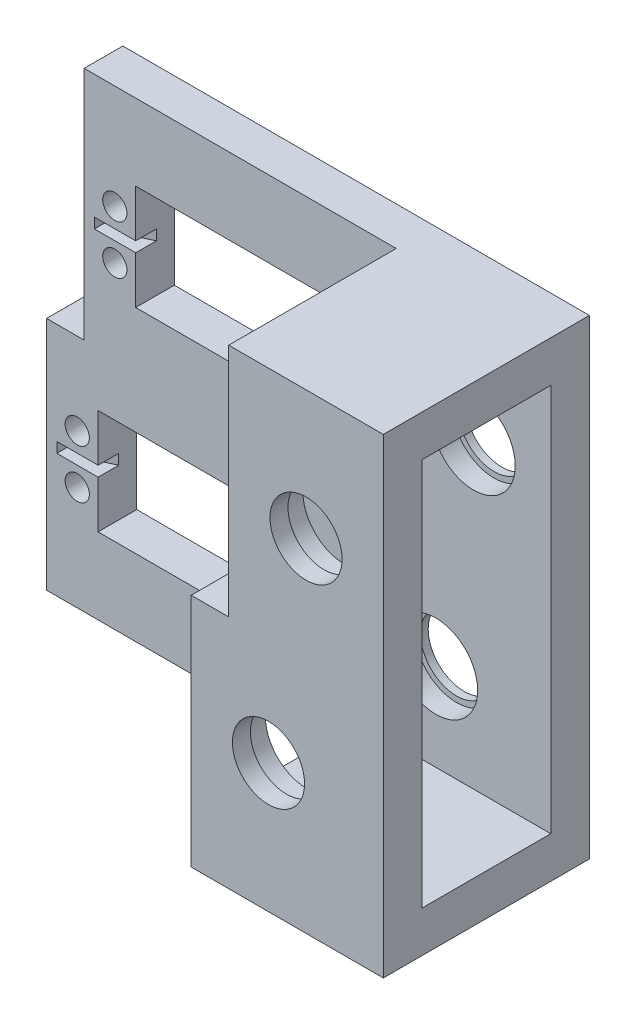
from build123d import *
from OCP.BRepFilletAPI import BRepFilletAPI_MakeChamfer

# Parameters (mm, degrees)
SKETCH1_W           = 37.293223462
SKETCH1_H           = 91.361925627
SKETCH1_R           = 8.1
BOSS_EXTRUDE1_DEPTH = 40
CUT_EXTRUDE1_START  = 8
SKETCH2_W           = 37.293223462
SKETCH2_H           = 25
CUT_EXTRUDE1_DEPTH  = 95.195837814
BOSS_EXTRUDE2_START = -3.5
SKETCH10_R          = 8.1
SKETCH10_R_2        = 7
SKETCH10_R_3        = 10.837031589
BOSS_EXTRUDE2_DEPTH = 3.5
SKETCH11_R          = 8.1
SKETCH11_R_2        = 7
BOSS_EXTRUDE3_DEPTH = 3.5
SKETCH12_W          = 40.9
SKETCH12_H          = 20.4
BOSS_EXTRUDE4_DEPTH = 7.5
CUT_EXTRUDE2_REACH  = 127.125
SKETCH13_R          = 2.3495
SKETCH22_W          = 8
SKETCH22_H          = 2
CUT_EXTRUDE6_DEPTH  = 2
SKETCH14_W          = 37.293223462
SKETCH14_H          = 8
BOSS_EXTRUDE5_DEPTH = 25
CUT_EXTRUDE4_START  = -32.5
SKETCH18_W          = 7.293223462
SKETCH18_H          = 45.680962814
CUT_EXTRUDE4_DEPTH  = 32.5
SKETCH15_R          = 11
CUT_EXTRUDE3_DEPTH  = 2
CHAMFER2_SIZE       = 2
CHAMFER2_SIZE2      = 4.289013841


with BuildPart() as part:
    # Sketch1 → Boss-Extrude1 (new body)
    with BuildSketch(Plane.XY):
        with Locations((3.646611731, 45.680962814)):
            Rectangle(SKETCH1_W, SKETCH1_H)
        with Locations((0, 25)):
            Circle(SKETCH1_R, mode=Mode.SUBTRACT)
        with Locations((7.293223462, 66.361925627)):
            Circle(SKETCH1_R, mode=Mode.SUBTRACT)
    extrude(amount=BOSS_EXTRUDE1_DEPTH)

    # Sketch2 → Cut-Extrude1 (cut, through all)
    with BuildSketch(Plane(origin=(0, 0, 0), x_dir=(1, 0, 0), z_dir=(0, 1, 0)).offset(CUT_EXTRUDE1_START)):
        with Locations((3.646611731, -20)):
            Rectangle(SKETCH2_W, SKETCH2_H)
    extrude(amount=CUT_EXTRUDE1_DEPTH, mode=Mode.SUBTRACT)

    # Sketch10 → Boss-Extrude2 (add)
    # profile 1 of 2: a face of its own
    with BuildSketch(Plane.XY.offset(40).offset(BOSS_EXTRUDE2_START)):
        with Locations(Location((7.293223462, 66.361925627, 0), (0, 0, 180))):
            Circle(SKETCH10_R)
        with Locations((7.293223462, 66.361925627)):
            Circle(SKETCH10_R_2, mode=Mode.SUBTRACT)
    # profile 2 of 2: a face of its own
    with BuildSketch(Plane.XY.offset(40).offset(BOSS_EXTRUDE2_START)):
        with Locations((0, 25)):
            Circle(SKETCH10_R_3)
        with Locations((0, 25)):
            Circle(SKETCH10_R_2, mode=Mode.SUBTRACT)
    extrude(amount=BOSS_EXTRUDE2_DEPTH)

    # Sketch11 → Boss-Extrude3 (add)
    # profile 1 of 2: a face of its own
    with BuildSketch(Plane(origin=(0, 0, 0), x_dir=(-1, 0, 0), z_dir=(0, 0, -1))):
        with Locations((-7.293223462, 66.361925627)):
            Circle(SKETCH11_R)
        with Locations(Location((-7.293223462, 66.361925627, 0), (0, 0, 180))):
            Circle(SKETCH11_R_2, mode=Mode.SUBTRACT)
    # profile 2 of 2: a face of its own
    with BuildSketch(Plane(origin=(0, 0, 0), x_dir=(-1, 0, 0), z_dir=(0, 0, -1))):
        with Locations((0, 25)):
            Circle(SKETCH11_R)
        with Locations(Location((0, 25, 0), (0, 0, 180))):
            Circle(SKETCH11_R_2, mode=Mode.SUBTRACT)
    extrude(amount=-BOSS_EXTRUDE3_DEPTH)

    # Sketch12 → Boss-Extrude4 (add)
    with BuildSketch(Plane(origin=(0, 0, 0), x_dir=(-1, 0, 0), z_dir=(0, 0, -1))):
        Polygon((15, 0), (75.56, 0), (75.56, 45.680962813), (68.266776538, 45.680962813), (68.266776538, 91.361925627), (15, 91.361925627), align=None)
        with Locations((45.11, 25)):
            Rectangle(SKETCH12_W, SKETCH12_H, mode=Mode.SUBTRACT)
        with Locations((37.816776538, 66.361925627)):
            Rectangle(SKETCH12_W, SKETCH12_H, mode=Mode.SUBTRACT)
    extrude(amount=-BOSS_EXTRUDE4_DEPTH)

    # Sketch13 → Cut-Extrude2 (cut, up to next)
    with BuildSketch(Plane(origin=(0, 0, 0), x_dir=(-1, 0, 0), z_dir=(0, 0, -1)), mode=Mode.PRIVATE) as cut_extrude2_sk1:
        with Locations((20.61, 29.75)):
            Circle(SKETCH13_R)
    cut_extrude2_tool1 = extrude(cut_extrude2_sk1.sketch, amount=-CUT_EXTRUDE2_REACH, mode=Mode.PRIVATE) & part.part
    # Sketch13 → Cut-Extrude2 (cut, up to next)
    with BuildSketch(Plane(origin=(0, 0, 0), x_dir=(-1, 0, 0), z_dir=(0, 0, -1)), mode=Mode.PRIVATE) as cut_extrude2_sk2:
        with Locations((20.61, 20.25)):
            Circle(SKETCH13_R)
    cut_extrude2_tool2 = extrude(cut_extrude2_sk2.sketch, amount=-CUT_EXTRUDE2_REACH, mode=Mode.PRIVATE) & part.part
    # Sketch13 → Cut-Extrude2 (cut, up to next)
    with BuildSketch(Plane(origin=(0, 0, 0), x_dir=(-1, 0, 0), z_dir=(0, 0, -1)), mode=Mode.PRIVATE) as cut_extrude2_sk3:
        with Locations((69.61, 29.75)):
            Circle(SKETCH13_R)
    cut_extrude2_tool3 = extrude(cut_extrude2_sk3.sketch, amount=-CUT_EXTRUDE2_REACH, mode=Mode.PRIVATE) & part.part
    # Sketch13 → Cut-Extrude2 (cut, up to next)
    with BuildSketch(Plane(origin=(0, 0, 0), x_dir=(-1, 0, 0), z_dir=(0, 0, -1)), mode=Mode.PRIVATE) as cut_extrude2_sk4:
        with Locations((69.61, 20.25)):
            Circle(SKETCH13_R)
    cut_extrude2_tool4 = extrude(cut_extrude2_sk4.sketch, amount=-CUT_EXTRUDE2_REACH, mode=Mode.PRIVATE) & part.part
    # Sketch13 → Cut-Extrude2 (cut, up to next)
    with BuildSketch(Plane(origin=(0, 0, 0), x_dir=(-1, 0, 0), z_dir=(0, 0, -1)), mode=Mode.PRIVATE) as cut_extrude2_sk5:
        with Locations((13.316776538, 71.111925627)):
            Circle(SKETCH13_R)
    cut_extrude2_tool5 = extrude(cut_extrude2_sk5.sketch, amount=-CUT_EXTRUDE2_REACH, mode=Mode.PRIVATE) & part.part
    # Sketch13 → Cut-Extrude2 (cut, up to next)
    with BuildSketch(Plane(origin=(0, 0, 0), x_dir=(-1, 0, 0), z_dir=(0, 0, -1)), mode=Mode.PRIVATE) as cut_extrude2_sk6:
        with Locations((13.316776538, 61.611925627)):
            Circle(SKETCH13_R)
    cut_extrude2_tool6 = extrude(cut_extrude2_sk6.sketch, amount=-CUT_EXTRUDE2_REACH, mode=Mode.PRIVATE) & part.part
    # Sketch13 → Cut-Extrude2 (cut, up to next)
    with BuildSketch(Plane(origin=(0, 0, 0), x_dir=(-1, 0, 0), z_dir=(0, 0, -1)), mode=Mode.PRIVATE) as cut_extrude2_sk7:
        with Locations((62.316776538, 71.111925627)):
            Circle(SKETCH13_R)
    cut_extrude2_tool7 = extrude(cut_extrude2_sk7.sketch, amount=-CUT_EXTRUDE2_REACH, mode=Mode.PRIVATE) & part.part
    # Sketch13 → Cut-Extrude2 (cut, up to next)
    with BuildSketch(Plane(origin=(0, 0, 0), x_dir=(-1, 0, 0), z_dir=(0, 0, -1)), mode=Mode.PRIVATE) as cut_extrude2_sk8:
        with Locations((62.316776538, 61.611925627)):
            Circle(SKETCH13_R)
    cut_extrude2_tool8 = extrude(cut_extrude2_sk8.sketch, amount=-CUT_EXTRUDE2_REACH, mode=Mode.PRIVATE) & part.part
    add(cut_extrude2_tool1.solids().sort_by_distance((-20.61, 29.75, 0))[0], mode=Mode.SUBTRACT)
    add(cut_extrude2_tool2.solids().sort_by_distance((-20.61, 20.25, 0))[0], mode=Mode.SUBTRACT)
    add(cut_extrude2_tool3.solids().sort_by_distance((-69.61, 29.75, 0))[0], mode=Mode.SUBTRACT)
    add(cut_extrude2_tool4.solids().sort_by_distance((-69.61, 20.25, 0))[0], mode=Mode.SUBTRACT)
    add(cut_extrude2_tool5.solids().sort_by_distance((-13.316777, 71.111926, 0))[0], mode=Mode.SUBTRACT)
    add(cut_extrude2_tool6.solids().sort_by_distance((-13.316777, 61.611926, 0))[0], mode=Mode.SUBTRACT)
    add(cut_extrude2_tool7.solids().sort_by_distance((-62.316777, 71.111926, 0))[0], mode=Mode.SUBTRACT)
    add(cut_extrude2_tool8.solids().sort_by_distance((-62.316777, 61.611926, 0))[0], mode=Mode.SUBTRACT)

    # Sketch22 → Cut-Extrude6 (cut)
    with BuildSketch(Plane.XY.offset(7.5)):
        with Locations((-62.266776538, 66.361925627)):
            Rectangle(SKETCH22_W, SKETCH22_H)
        with Locations((-13.366776538, 66.361925627)):
            Rectangle(SKETCH22_W, SKETCH22_H)
        with Locations((-20.66, 25)):
            Rectangle(SKETCH22_W, SKETCH22_H)
        with Locations((-69.56, 25)):
            Rectangle(SKETCH22_W, SKETCH22_H)
    extrude(amount=-CUT_EXTRUDE6_DEPTH, mode=Mode.SUBTRACT)

    # Sketch14 → Boss-Extrude5 (add)
    with BuildSketch(Plane.XY.offset(7.5)):
        with Locations((3.646611731, 87.361925627)):
            Rectangle(SKETCH14_W, SKETCH14_H)
    extrude(amount=BOSS_EXTRUDE5_DEPTH)

    # Sketch18 → Cut-Extrude4 (cut)
    with BuildSketch(Plane.XY.offset(40).offset(CUT_EXTRUDE4_START)):
        with Locations((-11.353388269, 68.52144422)):
            Rectangle(SKETCH18_W, SKETCH18_H)
    extrude(amount=CUT_EXTRUDE4_DEPTH, mode=Mode.SUBTRACT)

    # Sketch15 → Cut-Extrude3 (cut)
    with BuildSketch(Plane(origin=(0, 0, 0), x_dir=(-1, 0, 0), z_dir=(0, 0, -1))):
        with Locations((0, 25)):
            Circle(SKETCH15_R)
        with Locations((-7.293223462, 66.361925627)):
            Circle(SKETCH15_R)
    extrude(amount=-CUT_EXTRUDE3_DEPTH, mode=Mode.SUBTRACT)

    # Chamfer2: one chamfer whose edges measure the first distance from different faces: ONE call of the kernel's chamfer builder (chamfer() names one face for all edges)
    chamfer2_edges_1 = [part.edges().sort_by_distance(p)[0] for p in [
        (-65.56, 25, 5.5),
    ]]
    chamfer2_side_1 = [part.faces().sort_by_distance(p)[0] for p in [
        (-65.56, 25, 3.676174497),
    ]]
    chamfer2_edges_2 = [part.edges().sort_by_distance(p)[0] for p in [
        (-24.66, 25, 5.5),
    ]]
    chamfer2_side_2 = [part.faces().sort_by_distance(p)[0] for p in [
        (-24.66, 25, 3.676174497),
    ]]
    chamfer2_edges_3 = [part.edges().sort_by_distance(p)[0] for p in [
        (-17.366776538, 66.361925627, 5.5),
    ]]
    chamfer2_side_3 = [part.faces().sort_by_distance(p)[0] for p in [
        (-17.366776538, 66.361925627, 3.676174497),
    ]]
    chamfer2_edges_4 = [part.edges().sort_by_distance(p)[0] for p in [
        (-58.266776538, 66.361925627, 5.5),
    ]]
    chamfer2_side_4 = [part.faces().sort_by_distance(p)[0] for p in [
        (-58.266776538, 66.361925627, 3.676174497),
    ]]
    chamfer2 = BRepFilletAPI_MakeChamfer(part.part.solid().wrapped)
    for e in chamfer2_edges_1:
        chamfer2.Add(CHAMFER2_SIZE, CHAMFER2_SIZE2, e.wrapped, chamfer2_side_1[0].wrapped)  # the first distance lies on this face
    for e in chamfer2_edges_2:
        chamfer2.Add(CHAMFER2_SIZE, CHAMFER2_SIZE2, e.wrapped, chamfer2_side_2[0].wrapped)  # the first distance lies on this face
    for e in chamfer2_edges_3:
        chamfer2.Add(CHAMFER2_SIZE, CHAMFER2_SIZE2, e.wrapped, chamfer2_side_3[0].wrapped)  # the first distance lies on this face
    for e in chamfer2_edges_4:
        chamfer2.Add(CHAMFER2_SIZE, CHAMFER2_SIZE2, e.wrapped, chamfer2_side_4[0].wrapped)  # the first distance lies on this face
    add(Compound.cast(chamfer2.Shape()), mode=Mode.REPLACE)


solid = part.part
